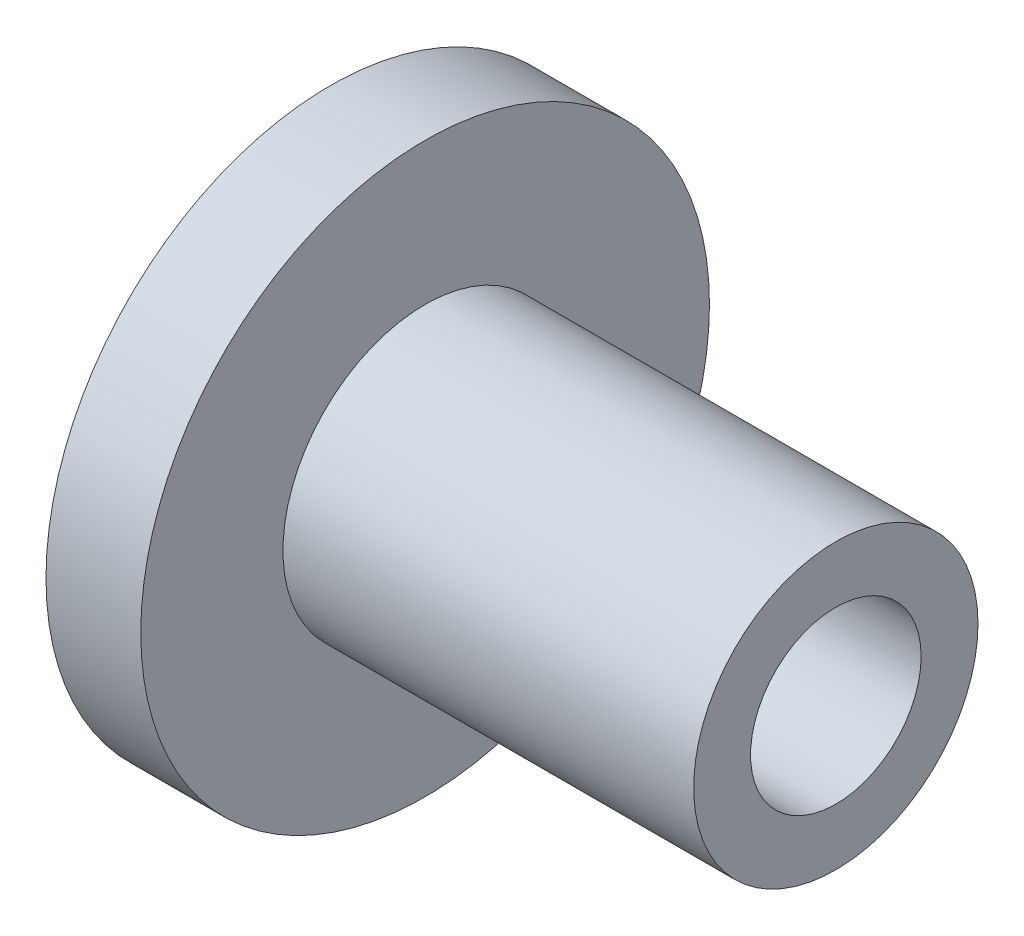
from build123d import *


with BuildPart() as part:
    # Эскиз1 → Повернуть1 (revolve)
    with BuildSketch(Plane.XY, mode=Mode.PRIVATE) as revolve_1_sk:
        Polygon((0, 1.35), (0, 4.5), (1.5, 4.5), (1.5, 2.25), (8, 2.25), (8, 1.35), align=None)
    revolve(revolve_1_sk.sketch.rotate(Axis((0, 0, 0), (-1, 0, 0)), 90), axis=Axis((0, 0, 0), (-1, 0, 0)))


solid = part.part
